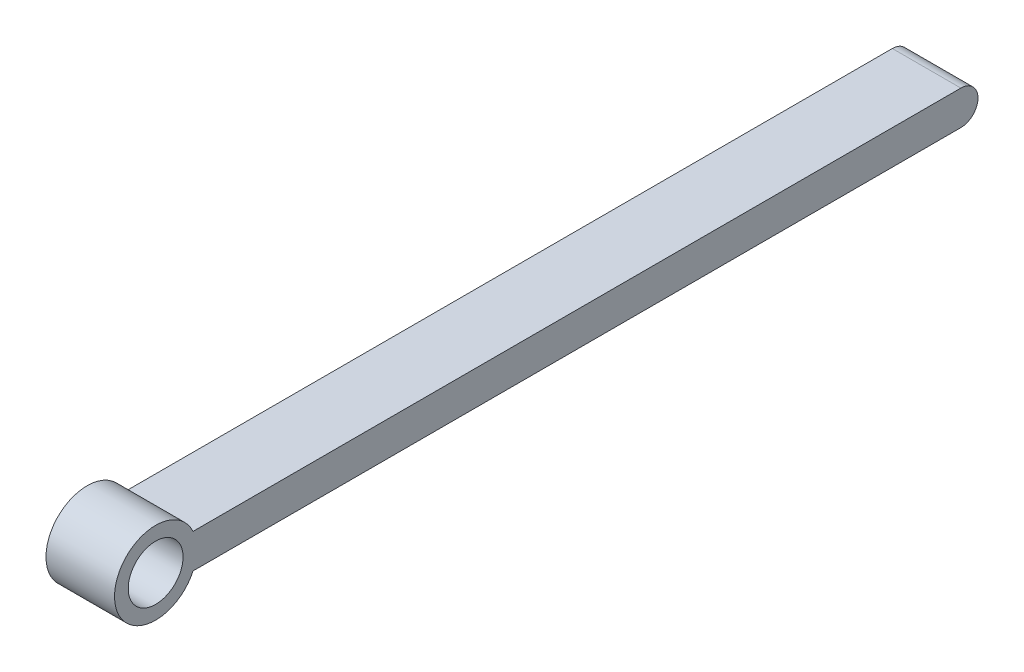
from build123d import *

# Parameters (mm, degrees)
BOSS_EXTRUDE1_DEPTH = 10


with BuildPart() as part:
    # Sketch1 → Boss-Extrude1 (new body)
    with BuildSketch(Plane(origin=(0, 0, 0), x_dir=(0, 0, -1), z_dir=(1, 0, 0))):
        with BuildLine():
            ThreePointArc((22.695346806, 15.624541707), (15.572847807, 18.124541707), (22.695346806, 20.624541707))
            Line((22.695346806, 20.624541707), (25.027203864, 20.624541707))
            ThreePointArc((25.027203864, 20.624541707), (13.572847807, 18.124541707), (25.027203864, 15.624541707))
            Line((25.027203864, 15.624541707), (22.695346806, 15.624541707))
        make_face()
        with BuildLine():
            Line((25.027203864, 20.624541707), (22.695346806, 20.624541707))
            ThreePointArc((22.695346806, 20.624541707), (23.347102435, 19.449306592), (23.572847807, 18.124541707))
            ThreePointArc((23.572847807, 18.124541707), (23.347102435, 16.799776821), (22.695346806, 15.624541707))
            Line((22.695346806, 15.624541707), (25.027203864, 15.624541707))
            ThreePointArc((25.027203864, 15.624541707), (25.434849869, 16.84511534), (25.572847807, 18.124541707))
            ThreePointArc((25.572847807, 18.124541707), (25.434849869, 19.403968074), (25.027203864, 20.624541707))
        make_face()
        with BuildLine():
            Line((137.072847807, 20.624541707), (25.027203864, 20.624541707))
            ThreePointArc((25.027203864, 20.624541707), (25.434849869, 19.403968074), (25.572847807, 18.124541707))
            ThreePointArc((25.572847807, 18.124541707), (25.434849869, 16.84511534), (25.027203864, 15.624541707))
            Line((25.027203864, 15.624541707), (137.072847807, 15.624541707))
            Line((137.072847807, 15.624541707), (137.072847807, 20.624541707))
        make_face()
        with BuildLine():
            ThreePointArc((137.072847807, 20.624541707), (139.572847807, 18.124541707), (137.072847807, 15.624541707))
            Line((137.072847807, 15.624541707), (137.072847807, 20.624541707))
        make_face()
    extrude(amount=BOSS_EXTRUDE1_DEPTH)


solid = part.part
